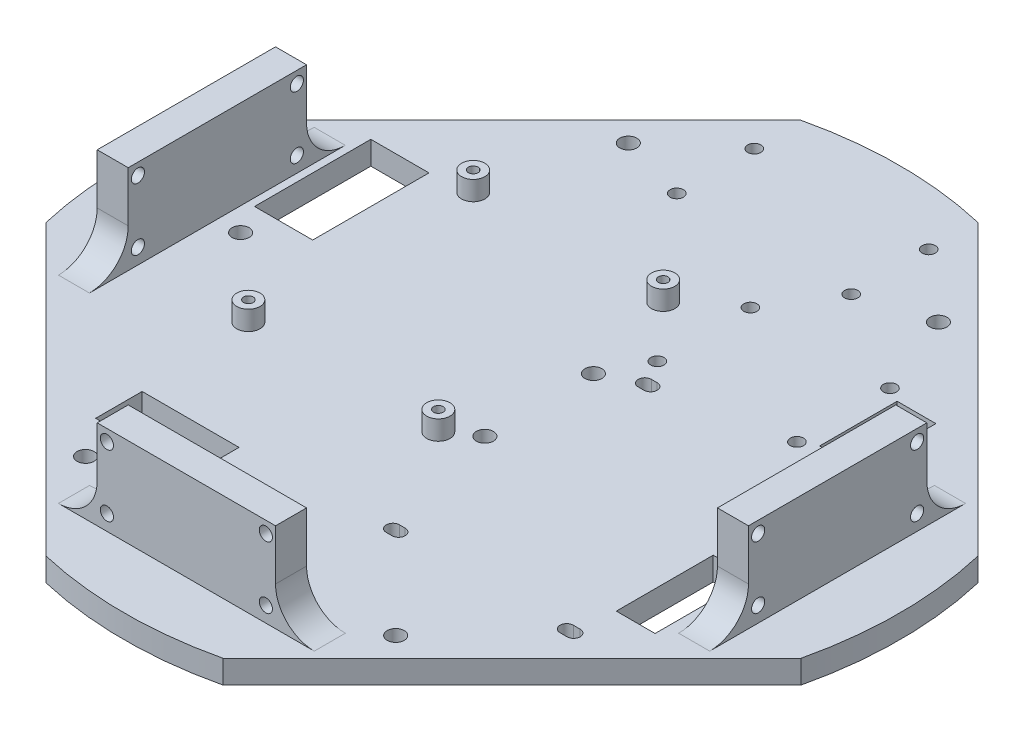
from build123d import *

# Parameters (mm, degrees)
BOSS_EXTRUDE1_DEPTH = 6
SKETCH2_R           = 1.7
SKETCH2_R_2         = 1.25
SKETCH2_R_3         = 2.2
SKETCH2_W           = 25
SKETCH2_H           = 12
SKETCH2_W_2         = 10
SKETCH2_H_2         = 20
SKETCH2_W_3         = 15
SKETCH2_H_3         = 30
SKETCH2_H_4         = 25
CUT_EXTRUDE1_DEPTH  = 142.548578234
SKETCH3_W           = 8
SKETCH3_H           = 46
SKETCH3_W_2         = 46
SKETCH3_H_2         = 8
BOSS_EXTRUDE2_DEPTH = 23
SKETCH4_R           = 1.7
CUT_EXTRUDE2_DEPTH  = 212.416650243
SKETCH5_R           = 1.7
CUT_EXTRUDE3_DEPTH  = 212.416650243
FILLET1_R           = 10
BOSS_EXTRUDE3_START = 5
SKETCH7_R           = 3
SKETCH7_R_2         = 1.25
BOSS_EXTRUDE3_DEPTH = 5


with BuildPart() as part:
    # Sketch1 → Boss-Extrude1 (new body)
    with BuildSketch(Plane(origin=(0, 0, 0), x_dir=(1, 0, 0), z_dir=(0, 1, 0))):
        with BuildLine():
            Line((97.353237465, -22.854915336), (22.854915336, -97.353237465))
            ThreePointArc((22.854915336, -97.353237465), (0, -100), (-22.854915336, -97.353237465))
            Line((-22.854915336, -97.353237465), (-97.353237465, -22.854915336))
            ThreePointArc((-97.353237465, -22.854915336), (-100, 0), (-97.353237465, 22.854915336))
            Line((-97.353237465, 22.854915336), (-22.854915336, 97.353237465))
            ThreePointArc((-22.854915336, 97.353237465), (0, 100), (22.854915336, 97.353237465))
            Line((22.854915336, 97.353237465), (97.353237465, 22.854915336))
            ThreePointArc((97.353237465, 22.854915336), (100, 0), (97.353237465, -22.854915336))
        make_face()
    extrude(amount=BOSS_EXTRUDE1_DEPTH)

    # Sketch2 → Cut-Extrude1 (cut, through all)
    with BuildSketch(Plane(origin=(0, 6, 0), x_dir=(1, 0, 0), z_dir=(0, 1, 0))):
        with Locations(Location((12.5, 25, 0), (0, 0, 270))):
            Circle(SKETCH2_R)
        with Locations(Location((48.5, 25, 0), (0, 0, 270))):
            Circle(SKETCH2_R)
        with Locations(Location((48.5, 49, 0), (0, 0, 270))):
            Circle(SKETCH2_R)
        with Locations(Location((12.5, 49, 0), (0, 0, 270))):
            Circle(SKETCH2_R)
        with Locations(Location((-49, 39, 0), (0, 0, 270))):
            Circle(SKETCH2_R_2)
        with Locations(Location((0, 39, 0), (0, 0, 270))):
            Circle(SKETCH2_R_2)
        with Locations(Location((-49, -19, 0), (0, 0, 270))):
            Circle(SKETCH2_R_2)
        with Locations(Location((0, -19, 0), (0, 0, 270))):
            Circle(SKETCH2_R_2)
        with Locations(Location((-22.5, 85, 0), (0, 0, 270))):
            Circle(SKETCH2_R)
        with Locations(Location((22.5, 85, 0), (0, 0, 270))):
            Circle(SKETCH2_R)
        with Locations(Location((22.5, 65, 0), (0, 0, 270))):
            Circle(SKETCH2_R)
        with Locations(Location((-22.5, 65, 0), (0, 0, 270))):
            Circle(SKETCH2_R)
        with Locations(Location((-40, -70, 0), (0, 0, 270))):
            Circle(SKETCH2_R_3)
        with Locations(Location((40, -70, 0), (0, 0, 270))):
            Circle(SKETCH2_R_3)
        with Locations(Location((40, 70, 0), (0, 0, 270))):
            Circle(SKETCH2_R_3)
        with Locations(Location((-40, 70, 0), (0, 0, 270))):
            Circle(SKETCH2_R_3)
        with Locations(Location((-70, 0, 0), (0, 0, 270))):
            Circle(SKETCH2_R_3)
        with Locations(Location((70, 0, 0), (0, 0, 270))):
            Circle(SKETCH2_R_3)
        with Locations(Location((7, -14, 0), (0, 0, 270))):
            Circle(SKETCH2_R_3)
        with Locations(Location((7, 14, 0), (0, 0, 90))):
            Circle(SKETCH2_R_3)
        with BuildLine():
            Line((15.75, 20.2), (17.25, 20.2))
            ThreePointArc((17.25, 20.2), (18.95, 18.5), (17.25, 16.8))
            Line((17.25, 16.8), (15.75, 16.8))
            ThreePointArc((15.75, 16.8), (14.05, 18.5), (15.75, 20.2))
        make_face()
        with BuildLine():
            Line((60.6, 20.2), (62.4, 20.2))
            ThreePointArc((62.4, 20.2), (64.1, 18.5), (62.4, 16.8))
            Line((62.4, 16.8), (60.6, 16.8))
            ThreePointArc((60.6, 16.8), (58.9, 18.5), (60.6, 20.2))
        make_face()
        with BuildLine():
            Line((15.75, -44.8), (17.25, -44.8))
            ThreePointArc((17.25, -44.8), (18.95, -46.5), (17.25, -48.2))
            Line((17.25, -48.2), (15.75, -48.2))
            ThreePointArc((15.75, -48.2), (14.05, -46.5), (15.75, -44.8))
        make_face()
        with BuildLine():
            Line((60.6, -44.8), (62.4, -44.8))
            ThreePointArc((62.4, -44.8), (64.1, -46.5), (62.4, -48.2))
            Line((62.4, -48.2), (60.6, -48.2))
            ThreePointArc((60.6, -48.2), (58.9, -46.5), (60.6, -44.8))
        make_face()
        with Locations((-34.718614501, -54.191311461)):
            Rectangle(SKETCH2_W, SKETCH2_H)
        with Locations((57.34405649, 37)):
            Rectangle(SKETCH2_W_2, SKETCH2_H_2)
        with Locations((-66.546441163, 22.630683116)):
            Rectangle(SKETCH2_W_3, SKETCH2_H_3)
        with Locations((68.014377365, -23.609307251)):
            Rectangle(SKETCH2_W_2, SKETCH2_H_4)
    extrude(amount=-CUT_EXTRUDE1_DEPTH, mode=Mode.SUBTRACT)

    # Sketch3 → Boss-Extrude2 (add)
    with BuildSketch(Plane(origin=(0, 6, 0), x_dir=(1, 0, 0), z_dir=(0, 1, 0))):
        with Locations((-80, 0)):
            Rectangle(SKETCH3_W, SKETCH3_H)
        with Locations((0, -80)):
            Rectangle(SKETCH3_W_2, SKETCH3_H_2)
        with Locations((80, 0)):
            Rectangle(SKETCH3_W, SKETCH3_H)
    extrude(amount=BOSS_EXTRUDE2_DEPTH)

    # Sketch4 → Cut-Extrude2 (cut, through all)
    with BuildSketch(Plane.ZY.offset(84)):
        with Locations((-20.5, 26)):
            Circle(SKETCH4_R)
        with Locations((20.5, 26)):
            Circle(SKETCH4_R)
        with Locations((20.5, 10)):
            Circle(SKETCH4_R)
        with Locations((-20.5, 10)):
            Circle(SKETCH4_R)
    extrude(amount=-CUT_EXTRUDE2_DEPTH, mode=Mode.SUBTRACT)

    # Sketch5 → Cut-Extrude3 (cut, through all)
    with BuildSketch(Plane.XY.offset(84)):
        with Locations((-20.5, 26)):
            Circle(SKETCH5_R)
        with Locations((20.5, 26)):
            Circle(SKETCH5_R)
        with Locations((20.5, 10)):
            Circle(SKETCH5_R)
        with Locations((-20.5, 10)):
            Circle(SKETCH5_R)
    extrude(amount=-CUT_EXTRUDE3_DEPTH, mode=Mode.SUBTRACT)

    # Fillet1
    fillet1_edges = [part.edges().sort_by_distance(p)[0] for p in [
        (-80, 6, -23),
        (-80, 6, 23),
        (23, 6, 80),
        (-23, 6, 80),
        (80, 6, -23),
        (80, 6, 23),
    ]]
    fillet(fillet1_edges, radius=FILLET1_R)

    # Sketch7 → Boss-Extrude3 (add)
    # profile 1 of 4: a face of its own
    with BuildSketch(Plane(origin=(0, 6, 0), x_dir=(1, 0, 0), z_dir=(0, 1, 0)).offset(BOSS_EXTRUDE3_START)):
        with Locations(Location((-49, 39, 0), (0, 0, 270))):
            Circle(SKETCH7_R)
        with Locations(Location((-49, 39, 0), (0, 0, 270))):
            Circle(SKETCH7_R_2, mode=Mode.SUBTRACT)
    # profile 2 of 4: a face of its own
    with BuildSketch(Plane(origin=(0, 6, 0), x_dir=(1, 0, 0), z_dir=(0, 1, 0)).offset(BOSS_EXTRUDE3_START)):
        with Locations(Location((0, 39, 0), (0, 0, 270))):
            Circle(SKETCH7_R)
        with Locations(Location((0, 39, 0), (0, 0, 270))):
            Circle(SKETCH7_R_2, mode=Mode.SUBTRACT)
    # profile 3 of 4: a face of its own
    with BuildSketch(Plane(origin=(0, 6, 0), x_dir=(1, 0, 0), z_dir=(0, 1, 0)).offset(BOSS_EXTRUDE3_START)):
        with Locations(Location((0, -19, 0), (0, 0, 270))):
            Circle(SKETCH7_R)
        with Locations(Location((0, -19, 0), (0, 0, 270))):
            Circle(SKETCH7_R_2, mode=Mode.SUBTRACT)
    # profile 4 of 4: a face of its own
    with BuildSketch(Plane(origin=(0, 6, 0), x_dir=(1, 0, 0), z_dir=(0, 1, 0)).offset(BOSS_EXTRUDE3_START)):
        with Locations(Location((-49, -19, 0), (0, 0, 270))):
            Circle(SKETCH7_R)
        with Locations(Location((-49, -19, 0), (0, 0, 270))):
            Circle(SKETCH7_R_2, mode=Mode.SUBTRACT)
    extrude(amount=-BOSS_EXTRUDE3_DEPTH)


solid = part.part
